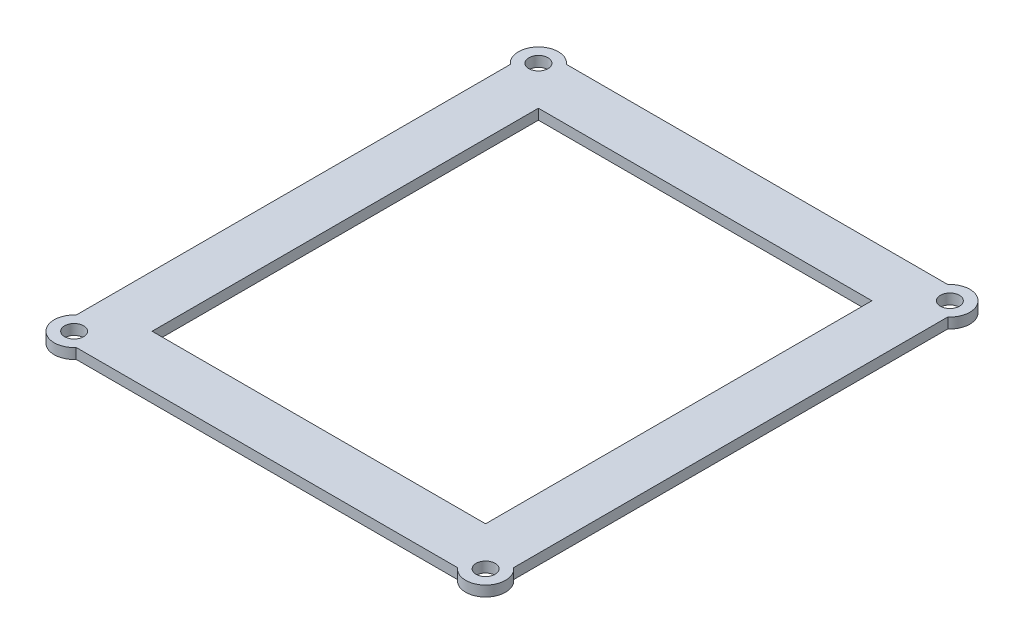
from build123d import *

# Parameters (mm, degrees)
SKETCH1_W           = 128.27
SKETCH1_H           = 143.764
SKETCH1_W_2         = 97.79
SKETCH1_H_2         = 113.284
BOSS_EXTRUDE1_DEPTH = 3.048
SKETCH2_R           = 2.794
CUT_EXTRUDE1_DEPTH  = 3.302
SKETCH4_R           = 5.842
SKETCH4_R_2         = 2.794
BOSS_EXTRUDE2_DEPTH = 3.048


with BuildPart() as part:
    # Sketch1 → Boss-Extrude1 (new body)
    with BuildSketch(Plane(origin=(0, 0, 0), x_dir=(1, 0, 0), z_dir=(0, 1, 0))):
        with Locations((64.135, 71.882)):
            Rectangle(SKETCH1_W, SKETCH1_H)
        with Locations((64.135, 71.882)):
            Rectangle(SKETCH1_W_2, SKETCH1_H_2, mode=Mode.SUBTRACT)
    extrude(amount=BOSS_EXTRUDE1_DEPTH)

    # Sketch2 → Cut-Extrude1 (cut)
    with BuildSketch(Plane(origin=(0, 3.048, 0), x_dir=(1, 0, 0), z_dir=(0, 1, 0))):
        with Locations(Location((3.81, 139.954, 0), (0, 0, 270))):
            Circle(SKETCH2_R)
        with Locations(Location((124.46, 139.954, 0), (0, 0, 270))):
            Circle(SKETCH2_R)
        with Locations(Location((124.46, 3.81, 0), (0, 0, 270))):
            Circle(SKETCH2_R)
        with Locations(Location((3.81, 3.81, 0), (0, 0, 270))):
            Circle(SKETCH2_R)
    extrude(amount=-CUT_EXTRUDE1_DEPTH, mode=Mode.SUBTRACT)

    # Sketch4 → Boss-Extrude2 (add, through all)
    # profile 1 of 4: a face of its own
    with BuildSketch(Plane(origin=(0, 3.048, 0), x_dir=(1, 0, 0), z_dir=(0, 1, 0))):
        with Locations((3.81, 139.954)):
            Circle(SKETCH4_R)
        with Locations(Location((3.81, 139.954, 0), (0, 0, 270))):
            Circle(SKETCH4_R_2, mode=Mode.SUBTRACT)
    # profile 2 of 4: a face of its own
    with BuildSketch(Plane(origin=(0, 3.048, 0), x_dir=(1, 0, 0), z_dir=(0, 1, 0))):
        with Locations((124.46, 139.954)):
            Circle(SKETCH4_R)
        with Locations(Location((124.46, 139.954, 0), (0, 0, 270))):
            Circle(SKETCH4_R_2, mode=Mode.SUBTRACT)
    # profile 3 of 4: a face of its own
    with BuildSketch(Plane(origin=(0, 3.048, 0), x_dir=(1, 0, 0), z_dir=(0, 1, 0))):
        with Locations((124.46, 3.81)):
            Circle(SKETCH4_R)
        with Locations(Location((124.46, 3.81, 0), (0, 0, 270))):
            Circle(SKETCH4_R_2, mode=Mode.SUBTRACT)
    # profile 4 of 4: a face of its own
    with BuildSketch(Plane(origin=(0, 3.048, 0), x_dir=(1, 0, 0), z_dir=(0, 1, 0))):
        with Locations((3.81, 3.81)):
            Circle(SKETCH4_R)
        with Locations(Location((3.81, 3.81, 0), (0, 0, 270))):
            Circle(SKETCH4_R_2, mode=Mode.SUBTRACT)
    extrude(amount=-BOSS_EXTRUDE2_DEPTH)


solid = part.part
